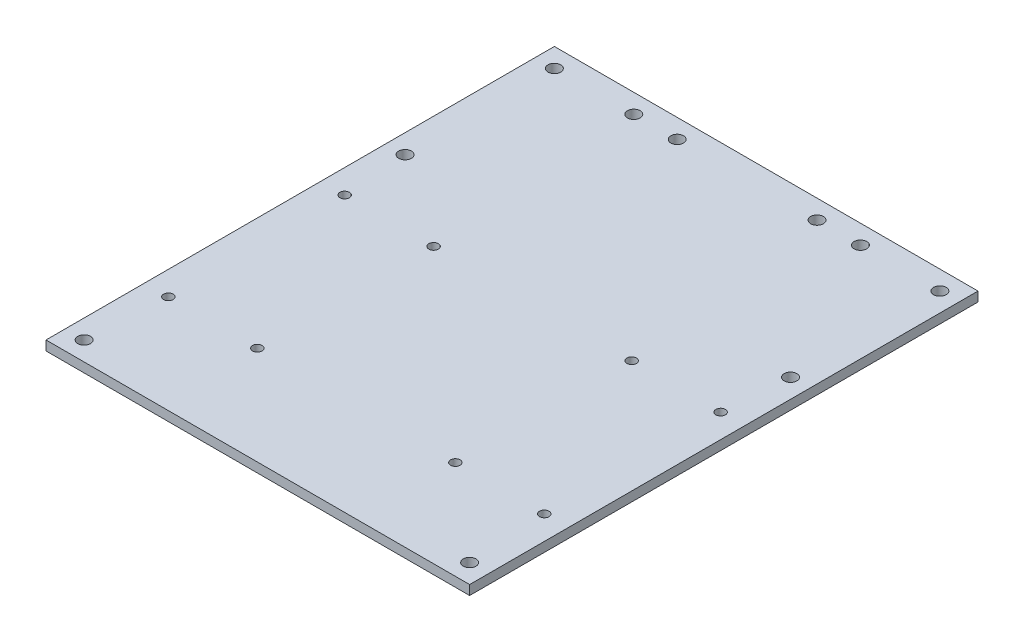
from build123d import *

# Parameters (mm, degrees)
ESQUISSE1_W             = 133.33
ESQUISSE1_H             = 160
BOSS_EXTRU_1_DEPTH      = 3
ESQUISSE2_R             = 2
ENL_V_MAT_EXTRU_1_DEPTH = 105.178799307
ESQUISSE3_R             = 2
ESQUISSE3_R_2           = 1.5
ENL_V_MAT_EXTRU_2_DEPTH = 105.178799307
ESQUISSE4_R             = 2
ENL_V_MAT_EXTRU_3_DEPTH = 3.175
ESQUISSE5_R             = 2
ENL_V_MAT_EXTRU_4_DEPTH = 105.178799307


with BuildPart() as part:
    # Esquisse1 → Boss.-Extru.1 (new body)
    with BuildSketch(Plane(origin=(0, 0, 0), x_dir=(1, 0, 0), z_dir=(0, 1, 0))):
        Rectangle(ESQUISSE1_W, ESQUISSE1_H)
    extrude(amount=BOSS_EXTRU_1_DEPTH)

    # Esquisse2 → Enlèv. mat.-Extru.1 (cut, through all)
    with BuildSketch(Plane(origin=(0, 3, 0), x_dir=(1, 0, 0), z_dir=(0, 1, 0))):
        with Locations(Location((-60.665, 74, 0), (0, 0, 270))):
            Circle(ESQUISSE2_R)
        with Locations(Location((60.665, 74, 0), (0, 0, 90))):
            Circle(ESQUISSE2_R)
        with Locations(Location((60.665, -74, 0), (0, 0, 270))):
            Circle(ESQUISSE2_R)
        with Locations(Location((-60.665, -74, 0), (0, 0, 90))):
            Circle(ESQUISSE2_R)
    extrude(amount=-ENL_V_MAT_EXTRU_1_DEPTH, mode=Mode.SUBTRACT)

    # Esquisse3 → Enlèv. mat.-Extru.2 (cut, through all)
    with BuildSketch(Plane(origin=(0, 3, 0), x_dir=(1, 0, 0), z_dir=(0, 1, 0))):
        with Locations(Location((-60.665, 27, 0), (0, 0, 270))):
            Circle(ESQUISSE3_R)
        with Locations(Location((60.665, 27, 0), (0, 0, 90))):
            Circle(ESQUISSE3_R)
        with Locations(Location((-59.165, 6.5, 0), (0, 0, 270))):
            Circle(ESQUISSE3_R_2)
        with Locations(Location((-31.165, 6.5, 0), (0, 0, 270))):
            Circle(ESQUISSE3_R_2)
        with Locations(Location((-59.165, -49, 0), (0, 0, 270))):
            Circle(ESQUISSE3_R_2)
        with Locations(Location((-31.165, -49, 0), (0, 0, 270))):
            Circle(ESQUISSE3_R_2)
        with Locations(Location((31.165, -49, 0), (0, 0, 90))):
            Circle(ESQUISSE3_R_2)
        with Locations(Location((59.165, -49, 0), (0, 0, 90))):
            Circle(ESQUISSE3_R_2)
        with Locations(Location((59.165, 6.5, 0), (0, 0, 90))):
            Circle(ESQUISSE3_R_2)
        with Locations(Location((31.165, 6.5, 0), (0, 0, 90))):
            Circle(ESQUISSE3_R_2)
    extrude(amount=-ENL_V_MAT_EXTRU_2_DEPTH, mode=Mode.SUBTRACT)

    # Esquisse4 → Enlèv. mat.-Extru.3 (cut)
    with BuildSketch(Plane(origin=(0, 3, 0), x_dir=(1, 0, 0), z_dir=(0, 1, 0))):
        with Locations(Location((-35.665, 74, 0), (0, 0, 270))):
            Circle(ESQUISSE4_R)
        with Locations(Location((35.665, 74, 0), (0, 0, 270))):
            Circle(ESQUISSE4_R)
    extrude(amount=-ENL_V_MAT_EXTRU_3_DEPTH, mode=Mode.SUBTRACT)

    # Esquisse5 → Enlèv. mat.-Extru.4 (cut, through all)
    with BuildSketch(Plane(origin=(0, 3, 0), x_dir=(1, 0, 0), z_dir=(0, 1, 0))):
        with Locations(Location((-22, 74, 0), (0, 0, 270))):
            Circle(ESQUISSE5_R)
        with Locations(Location((22, 74, 0), (0, 0, 90))):
            Circle(ESQUISSE5_R)
    extrude(amount=-ENL_V_MAT_EXTRU_4_DEPTH, mode=Mode.SUBTRACT)


solid = part.part
